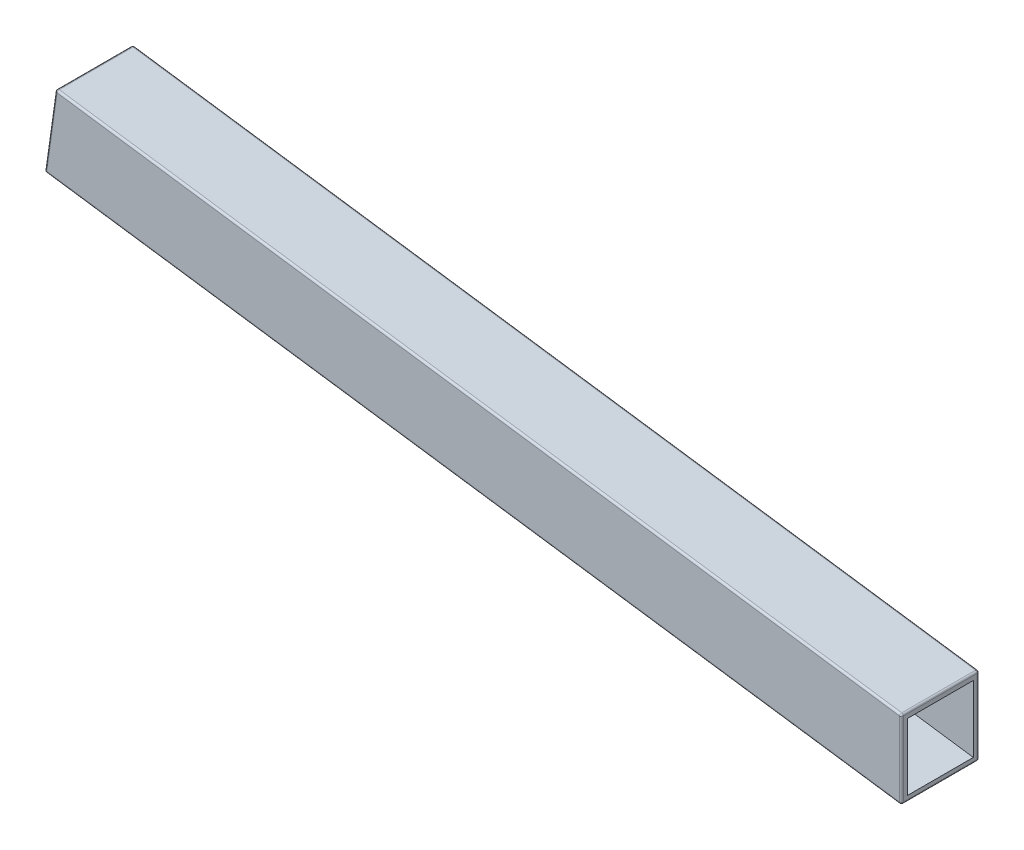
from build123d import *

# Parameters (mm, degrees)
BOSS_EXTRUDE1_DEPTH = 40
SKETCH2_W           = 34
SKETCH2_H           = 34
CUT_EXTRUDE1_DEPTH  = 448.413276673
FILLET1_R           = 1


with BuildPart() as part:
    # Sketch1 → Boss-Extrude1 (new body)
    with BuildSketch(Plane.XY):
        Polygon((0, 0), (-441.284874285, 62.018544574), (-435.717950246, 101.629267323), (0, 40.393102901), align=None)
    extrude(amount=BOSS_EXTRUDE1_DEPTH)

    # Sketch2 → Cut-Extrude1 (cut, through all)
    with BuildSketch(Plane(origin=(-441.284874285, 62.018544574, 0), x_dir=(0, 0, 1), z_dir=(-0.9902680687415704, 0.13917310096006613, 0))):
        with Locations((20, 20)):
            Rectangle(SKETCH2_W, SKETCH2_H)
    extrude(amount=-CUT_EXTRUDE1_DEPTH, mode=Mode.SUBTRACT)

    # Fillet1
    fillet1_edges = [part.edges().sort_by_distance(p)[0] for p in [
        (-438.501412265, 81.823905948, 40),
        (-220.642437142, 31.009272287, 40),
        (0, 20.19655145, 40),
        (-220.642437142, 31.009272287, 0),
        (-438.501412265, 81.823905948, 0),
        (-217.858975123, 71.011185112, 0),
        (0, 20.19655145, 0),
        (-217.858975123, 71.011185112, 40),
        (0, 0, 20),
        (-441.284874285, 62.018544574, 20),
        (-435.717950246, 101.629267323, 20),
        (0, 40.393102901, 20),
    ]]
    fillet(fillet1_edges, radius=FILLET1_R)


solid = part.part
